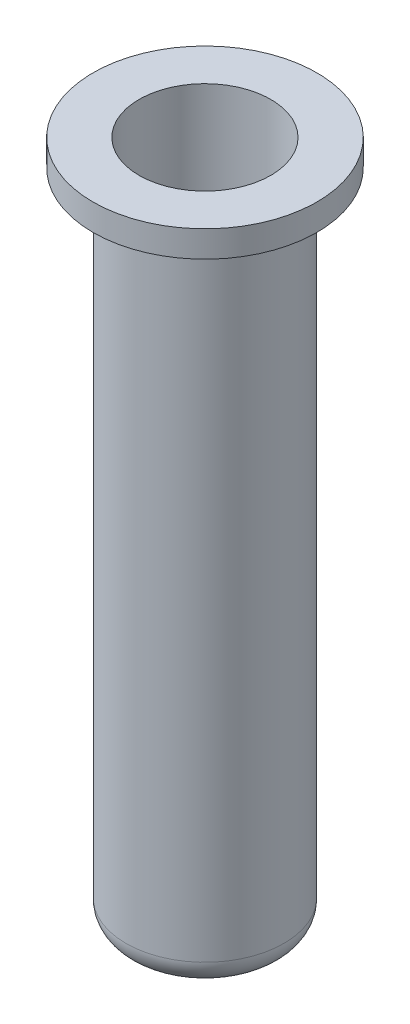
from build123d import *

# Parameters (mm, degrees)
SKETCH2_R           = 3
BOSS_EXTRUDE1_DEPTH = 26
SKETCH4_R           = 2.5
CUT_EXTRUDE1_DEPTH  = 14
FILLET3_R           = 1
BOSS_EXTRUDE2_START = -1
SKETCH5_R           = 4.25
SKETCH5_R_2         = 3
BOSS_EXTRUDE2_DEPTH = 1


with BuildPart() as part:
    # Sketch2 → Boss-Extrude1 (new body)
    with BuildSketch(Plane(origin=(0, 0, 0), x_dir=(1, 0, 0), z_dir=(0, 1, 0))):
        with Locations(Location((0, 0, 0), (0, 0, 270))):
            Circle(SKETCH2_R)
    extrude(amount=BOSS_EXTRUDE1_DEPTH)

    # Sketch4 → Cut-Extrude1 (cut)
    with BuildSketch(Plane(origin=(0, 26, 0), x_dir=(1, 0, 0), z_dir=(0, 1, 0))):
        with Locations(Location((0, 0, 0), (0, 0, 270))):
            Circle(SKETCH4_R)
    extrude(amount=-CUT_EXTRUDE1_DEPTH, mode=Mode.SUBTRACT)

    # Fillet3
    fillet3_edges = [part.edges().sort_by_distance(p)[0] for p in [
        (0, 0, -3),
    ]]
    fillet(fillet3_edges, radius=FILLET3_R)

    # Sketch5 → Boss-Extrude2 (add)
    with BuildSketch(Plane(origin=(0, 26, 0), x_dir=(1, 0, 0), z_dir=(0, 1, 0)).offset(BOSS_EXTRUDE2_START)):
        with Locations(Location((0, 0, 0), (0, 0, 270))):
            Circle(SKETCH5_R)
        with Locations(Location((0, 0, 0), (0, 0, 270))):
            Circle(SKETCH5_R_2, mode=Mode.SUBTRACT)
    extrude(amount=BOSS_EXTRUDE2_DEPTH)


solid = part.part
